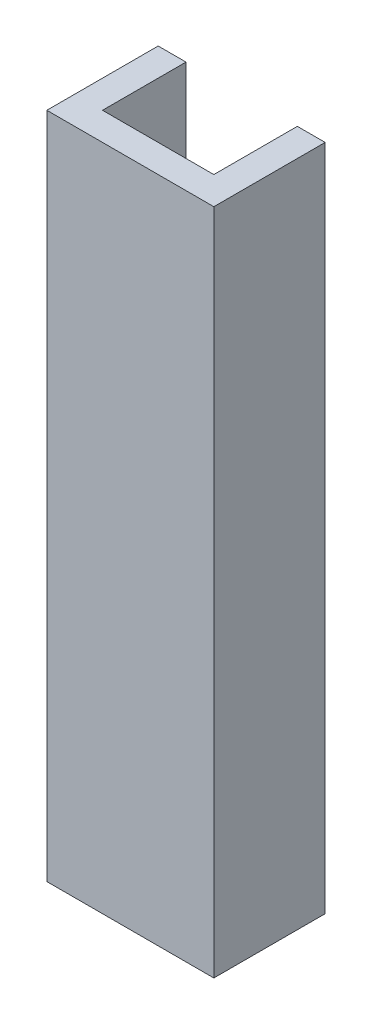
from build123d import *

# Parameters (mm, degrees)
EXTRUDE1_DEPTH = 609.6


with BuildPart() as part:
    # Sketch1 → Extrude1 (new body)
    with BuildSketch(Plane(origin=(0, 0, 0), x_dir=(1, 0, 0), z_dir=(0, 1, 0))):
        Polygon((50.8, 0), (-50.8, 0), (-50.8, 76.2), (-76.2, 76.2), (-76.2, -25.4), (76.2, -25.4), (76.2, 76.2), (50.8, 76.2), align=None)
    extrude(amount=EXTRUDE1_DEPTH)


solid = part.part
